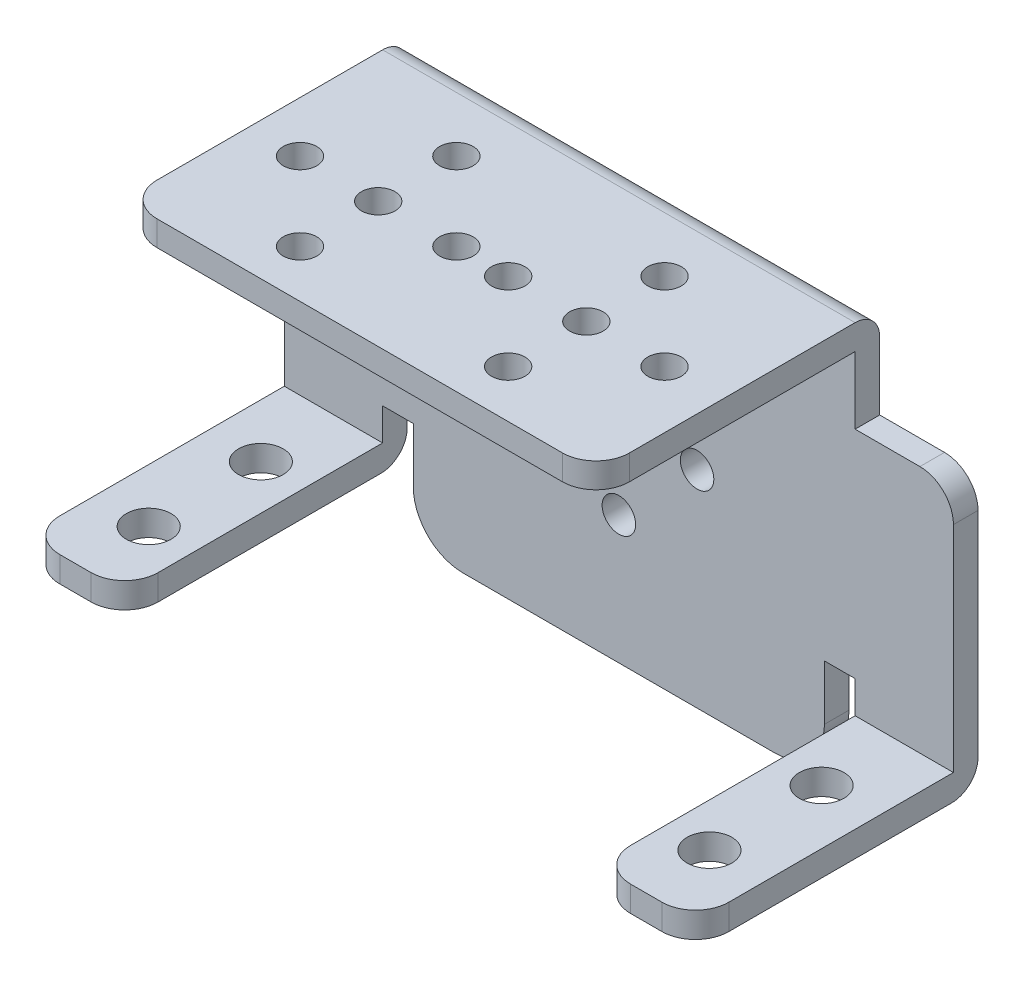
from build123d import *

# Parameters (mm, degrees)
BOSS_EXTRUDE1_DEPTH = 2.2
SKETCH1_3_W         = 42.3
SKETCH1_3_H         = 2.24
BOSS_EXTRUDE2_DEPTH = 25.4
SKETCH1_4_W         = 8.8
SKETCH1_4_H         = 2.28
BOSS_EXTRUDE3_DEPTH = 25.3
FILLET13_R          = 3
FILLET14_R          = 3
FILLET15_R          = 3
FILLET16_R          = 3
FILLET18_R          = 3
FILLET19_R          = 3
FILLET20_R          = 3
FILLET21_R          = 3
FILLET24_R          = 2.36
FILLET25_R          = 2.36
FILLET26_R          = 2.2
SKETCH2_R           = 2
CUT_EXTRUDE1_DEPTH  = 10
SKETCH3_R           = 1.5
CUT_EXTRUDE2_DEPTH  = 10
SKETCH4_R           = 1.5
CUT_EXTRUDE3_DEPTH  = 10


with BuildPart() as part:
    # Sketch1 → Boss-Extrude1 (new body)
    with BuildSketch(Plane.XY):
        Polygon((21.15, 16.24), (-21.15, 16.24), (-21.15, 10.22), (-21.15, -9.12), (-18.4, -9.12), (18.4, -9.12), (21.15, -9.12), (21.15, 10.22), align=None)
        with BuildLine():
            Line((-4.349812535, -18.48), (13.96, -18.48))
            ThreePointArc((13.96, -18.48), (17.099554108, -17.179554108), (18.4, -14.04))
            Line((18.4, -14.04), (18.4, -9.12))
            Line((18.4, -9.12), (-18.4, -9.12))
            Line((-18.4, -9.12), (-18.4, -14.04))
            ThreePointArc((-18.4, -14.04), (-17.099554108, -17.179554108), (-13.96, -18.48))
            Line((-13.96, -18.48), (-4.349812535, -18.48))
        make_face()
        Polygon((-21.15, -9.12), (-21.15, 10.22), (-29.95, 10.22), (-29.95, -12), (-21.15, -12), align=None)
        Polygon((29.95, 10.22), (21.15, 10.22), (21.15, -9.12), (21.15, -12), (29.95, -12), align=None)
    extrude(amount=BOSS_EXTRUDE1_DEPTH)

    # Sketch1<3> → Boss-Extrude2 (add)
    with BuildSketch(Plane.XY):
        with Locations((0, 17.36)):
            Rectangle(SKETCH1_3_W, SKETCH1_3_H)
    extrude(amount=BOSS_EXTRUDE2_DEPTH)

    # Sketch1<4> → Boss-Extrude3 (add)
    with BuildSketch(Plane.XY):
        with Locations((-25.55, -13.14)):
            Rectangle(SKETCH1_4_W, SKETCH1_4_H)
        with Locations((25.55, -13.14)):
            Rectangle(SKETCH1_4_W, SKETCH1_4_H)
    extrude(amount=BOSS_EXTRUDE3_DEPTH)

    # Fillet13
    fillet13_edges = [part.edges().sort_by_distance(p)[0] for p in [
        (-21.15, -13.14, 25.3),
    ]]
    fillet(fillet13_edges, radius=FILLET13_R)

    # Fillet14
    fillet14_edges = [part.edges().sort_by_distance(p)[0] for p in [
        (-29.95, -13.14, 25.3),
    ]]
    fillet(fillet14_edges, radius=FILLET14_R)

    # Fillet15
    fillet15_edges = [part.edges().sort_by_distance(p)[0] for p in [
        (29.95, -13.14, 25.3),
    ]]
    fillet(fillet15_edges, radius=FILLET15_R)

    # Fillet16
    fillet16_edges = [part.edges().sort_by_distance(p)[0] for p in [
        (21.15, -13.14, 25.3),
    ]]
    fillet(fillet16_edges, radius=FILLET16_R)

    # Fillet18
    fillet18_edges = [part.edges().sort_by_distance(p)[0] for p in [
        (21.15, 17.36, 25.4),
    ]]
    fillet(fillet18_edges, radius=FILLET18_R)

    # Fillet19
    fillet19_edges = [part.edges().sort_by_distance(p)[0] for p in [
        (-21.15, 17.36, 25.4),
    ]]
    fillet(fillet19_edges, radius=FILLET19_R)

    # Fillet20
    fillet20_edges = [part.edges().sort_by_distance(p)[0] for p in [
        (29.95, 10.22, 1.1),
    ]]
    fillet(fillet20_edges, radius=FILLET20_R)

    # Fillet21
    fillet21_edges = [part.edges().sort_by_distance(p)[0] for p in [
        (-29.95, 10.22, 1.1),
    ]]
    fillet(fillet21_edges, radius=FILLET21_R)

    # Fillet24
    fillet24_edges = [part.edges().sort_by_distance(p)[0] for p in [
        (-25.55, -14.28, 0),
    ]]
    fillet(fillet24_edges, radius=FILLET24_R)

    # Fillet25
    fillet25_edges = [part.edges().sort_by_distance(p)[0] for p in [
        (25.55, -14.28, 0),
    ]]
    fillet(fillet25_edges, radius=FILLET25_R)

    # Fillet26
    fillet26_edges = [part.edges().sort_by_distance(p)[0] for p in [
        (0, 18.48, 0),
    ]]
    fillet(fillet26_edges, radius=FILLET26_R)

    # Sketch2 → Cut-Extrude1 (cut)
    with BuildSketch(Plane.XZ.offset(14.28)):
        with Locations(Location((25.05, 19.14, 0), (0, 0, 270))):
            Circle(SKETCH2_R)
        with Locations(Location((25.05, 9.1, 0), (0, 0, 270))):
            Circle(SKETCH2_R)
        with Locations(Location((-25.15, 19.14, 0), (0, 0, 270))):
            Circle(SKETCH2_R)
        with Locations(Location((-25.15, 9.1, 0), (0, 0, 270))):
            Circle(SKETCH2_R)
    extrude(amount=-CUT_EXTRUDE1_DEPTH, mode=Mode.SUBTRACT)

    # Sketch3 → Cut-Extrude2 (cut)
    with BuildSketch(Plane(origin=(0, 18.48, 0), x_dir=(1, 0, 0), z_dir=(0, 1, 0))):
        with Locations(Location((9.03, -14.14, 0), (0, 0, 270))):
            Circle(SKETCH3_R)
        with Locations(Location((9.03, -7.14, 0), (0, 0, 270))):
            Circle(SKETCH3_R)
        with Locations(Location((16.03, -14.14, 0), (0, 0, 270))):
            Circle(SKETCH3_R)
        with Locations(Location((9.03, -21.14, 0), (0, 0, 270))):
            Circle(SKETCH3_R)
        with Locations(Location((2.03, -14.14, 0), (0, 0, 270))):
            Circle(SKETCH3_R)
        with Locations(Location((-9.605424329, -14.14, 0), (0, 0, 270))):
            Circle(SKETCH3_R)
        with Locations(Location((-9.605424329, -7.14, 0), (0, 0, 270))):
            Circle(SKETCH3_R)
        with Locations(Location((-2.605424329, -14.14, 0), (0, 0, 270))):
            Circle(SKETCH3_R)
        with Locations(Location((-9.605424329, -21.14, 0), (0, 0, 270))):
            Circle(SKETCH3_R)
        with Locations(Location((-16.605424329, -14.14, 0), (0, 0, 270))):
            Circle(SKETCH3_R)
    extrude(amount=-CUT_EXTRUDE2_DEPTH, mode=Mode.SUBTRACT)

    # Sketch4 → Cut-Extrude3 (cut)
    with BuildSketch(Plane(origin=(0, 0, 0), x_dir=(-1, 0, 0), z_dir=(0, 0, -1))):
        with Locations((-7, 0)):
            Circle(SKETCH4_R)
        with Locations((0, 7)):
            Circle(SKETCH4_R)
        with Locations((7, 0)):
            Circle(SKETCH4_R)
        with Locations((0, -7)):
            Circle(SKETCH4_R)
        Circle(SKETCH4_R)
    extrude(amount=-CUT_EXTRUDE3_DEPTH, mode=Mode.SUBTRACT)


solid = part.part
